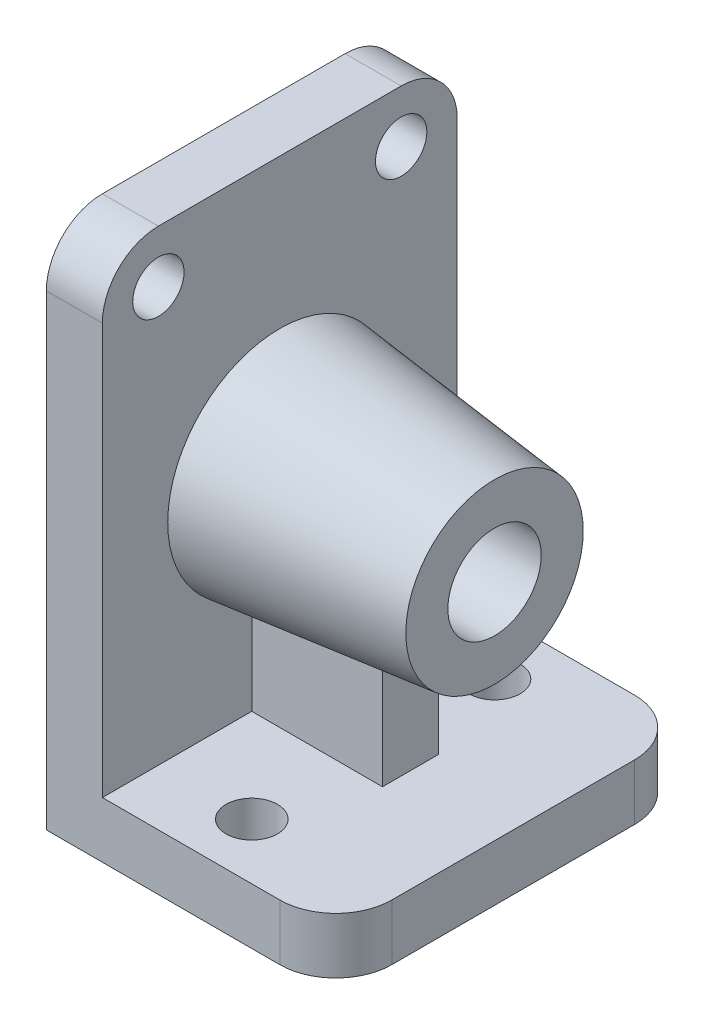
from build123d import *

# Parameters (mm, degrees)
BOSS_EXTRUDE1_DEPTH = 76
FILLET1_R           = 12
SKETCH5_R           = 5.5
CUT_EXTRUDE1_DEPTH  = 76
SKETCH6_R           = 5.5
CUT_EXTRUDE2_DEPTH  = 76
SKETCH17_R          = 10
CUT_EXTRUDE3_DEPTH  = 46
BOSS_EXTRUDE3_DEPTH = 28


with BuildPart() as part:
    # Sketch1 → Boss-Extrude1 (new body)
    with BuildSketch(Plane.XY):
        Polygon((0, 70.919324578), (0, -41.080675422), (62, -41.080675422), (62, -29.080675422), (12, -29.080675422), (12, 70.919324578), align=None)
    extrude(amount=-BOSS_EXTRUDE1_DEPTH)

    # Fillet1
    fillet1_edges = [part.edges().sort_by_distance(p)[0] for p in [
        (62, -35.080675422, -76),
        (6, 70.919324578, -76),
        (62, -35.080675422, 0),
        (6, 70.919324578, 0),
    ]]
    fillet(fillet1_edges, radius=FILLET1_R)

    # Sketch5 → Cut-Extrude1 (cut)
    with BuildSketch(Plane(origin=(0, -29.080675422, 0), x_dir=(1, 0, 0), z_dir=(0, 1, 0))):
        with Locations(Location((32, 12, 0), (0, 0, 180))):
            Circle(SKETCH5_R)
        with Locations(Location((32, 64, 0), (0, 0, 180))):
            Circle(SKETCH5_R)
    extrude(amount=-CUT_EXTRUDE1_DEPTH, mode=Mode.SUBTRACT)

    # Sketch6 → Cut-Extrude2 (cut)
    with BuildSketch(Plane(origin=(12, 0, 0), x_dir=(0, 0, -1), z_dir=(1, 0, 0))):
        with Locations(Location((12, 59.668220636, 0), (0, 0, 90))):
            Circle(SKETCH6_R)
        with Locations(Location((64, 59.668220636, 0), (0, 0, 90))):
            Circle(SKETCH6_R)
    extrude(amount=-CUT_EXTRUDE2_DEPTH, mode=Mode.SUBTRACT)

    # Sketch16 → Revolve1 (revolve)
    with BuildSketch(Plane.XY.offset(-38), mode=Mode.PRIVATE) as revolve1_sk:
        Polygon((12, 38.919324578), (12, 14.919324578), (58, 14.919324578), (58, 33.919324578), align=None)
    revolve(revolve1_sk.sketch.rotate(Axis((58, 14.919324578, -38), (-1, 0, 0)), 90), axis=Axis((58, 14.919324578, -38), (-1, 0, 0)))

    # Sketch17 → Cut-Extrude3 (cut)
    with BuildSketch(Plane(origin=(58, 0, 0), x_dir=(0, 0, -1), z_dir=(1, 0, 0))):
        with Locations((38, 14.919324578)):
            Circle(SKETCH17_R)
    extrude(amount=-CUT_EXTRUDE3_DEPTH, mode=Mode.SUBTRACT)

    # Sketch18 → Boss-Extrude3 (add)
    with BuildSketch(Plane(origin=(40, 0, 0), x_dir=(0, 0, -1), z_dir=(1, 0, 0))):
        with BuildLine():
            Line((32, -3.108431799), (32, -29.080675422))
            Line((32, -29.080675422), (44, -29.080675422))
            Line((44, -29.080675422), (44, -3.108431799))
            ThreePointArc((44, -3.108431799), (38, -4.080675422), (32, -3.108431799))
        make_face()
    extrude(amount=-BOSS_EXTRUDE3_DEPTH)


solid = part.part
